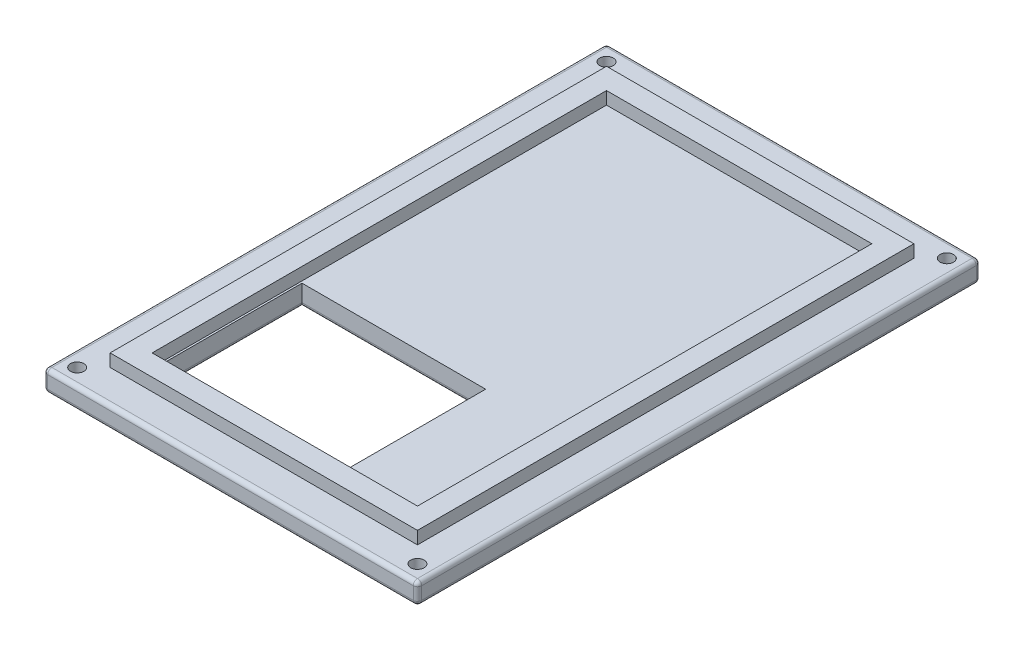
from build123d import *

# Parameters (mm, degrees)
SKETCH1_W           = 89
SKETCH1_H           = 134
BOSS_EXTRUDE1_DEPTH = 2.5
SKETCH3_W           = 73.15
SKETCH3_H           = 118.15
SKETCH3_W_2         = 63.15
SKETCH3_H_2         = 108.15
BOSS_EXTRUDE2_DEPTH = 3
CUT_EXTRUDE1_REACH  = 82.829
SKETCH5_W           = 43.701404931
SKETCH5_H           = 35.210158561
FILLET1_R           = 1
SKETCH8_R           = 2.9
CUT_EXTRUDE2_DEPTH  = 2.5
CUT_EXTRUDE3_REACH  = 82.619
SKETCH9_R           = 1.6


with BuildPart() as part:
    # Sketch1 → Boss-Extrude1 (new, symmetric)
    with BuildSketch(Plane(origin=(0, 0, 0), x_dir=(1, 0, 0), z_dir=(0, 1, 0))):
        Rectangle(SKETCH1_W, SKETCH1_H)
    extrude(amount=BOSS_EXTRUDE1_DEPTH, both=True)

    # Sketch3 → Boss-Extrude2 (add)
    with BuildSketch(Plane(origin=(0, 2.5, 0), x_dir=(1, 0, 0), z_dir=(0, 1, 0))):
        Rectangle(SKETCH3_W, SKETCH3_H)
        Rectangle(SKETCH3_W_2, SKETCH3_H_2, mode=Mode.SUBTRACT)
    extrude(amount=BOSS_EXTRUDE2_DEPTH)

    # Sketch5 → Cut-Extrude1 (cut, up to next)
    with BuildSketch(Plane.XZ.offset(2.5), mode=Mode.PRIVATE) as cut_extrude1_sk1:
        with Locations((-9.260550175, 36.46992072)):
            Rectangle(SKETCH5_W, SKETCH5_H)
    cut_extrude1_tool1 = extrude(cut_extrude1_sk1.sketch, amount=-CUT_EXTRUDE1_REACH, mode=Mode.PRIVATE) & part.part
    add(cut_extrude1_tool1.solids().sort_by_distance((-9.26055, -2.5, 36.469921))[0], mode=Mode.SUBTRACT)

    # Fillet1
    fillet1_edges = [part.edges().sort_by_distance(p)[0] for p in [
        (-44.5, 2.5, 0),
        (0, 2.5, 67),
        (-31.11125264, -2.5, 36.46992072),
        (-9.260550175, -2.5, 18.864841439),
        (12.590152291, -2.5, 36.46992072),
        (-9.260550175, -2.5, 54.075),
        (44.5, 2.5, 0),
        (0, -2.5, 67),
        (-44.5, -2.5, 0),
        (0, -2.5, -67),
        (44.5, -2.5, 0),
        (44.5, 0, 67),
        (-44.5, 0, 67),
        (-44.5, 0, -67),
        (44.5, 0, -67),
        (0, 2.5, -67),
    ]]
    fillet(fillet1_edges, radius=FILLET1_R)

    # Sketch8 → Cut-Extrude2 (cut)
    with BuildSketch(Plane.XZ.offset(2.5)):
        with Locations(Location((40.49479618, -62.99479618, 0), (0, 0, 270))):
            Circle(SKETCH8_R)
        with Locations(Location((-40.49479618, -62.99479618, 0), (0, 0, 90))):
            Circle(SKETCH8_R)
        with Locations(Location((40.49479618, 62.99479618, 0), (0, 0, 90))):
            Circle(SKETCH8_R)
        with Locations(Location((-40.49479618, 62.99479618, 0), (0, 0, 270))):
            Circle(SKETCH8_R)
    extrude(amount=-CUT_EXTRUDE2_DEPTH, mode=Mode.SUBTRACT)

    # Sketch9 → Cut-Extrude3 (cut, up to next)
    with BuildSketch(Plane.XZ, mode=Mode.PRIVATE) as cut_extrude3_sk1:
        with Locations(Location((40.49479618, -62.99479618, 0), (0, 0, 270))):
            Circle(SKETCH9_R)
    cut_extrude3_tool1 = extrude(cut_extrude3_sk1.sketch, amount=-CUT_EXTRUDE3_REACH, mode=Mode.PRIVATE) & part.part
    # Sketch9 → Cut-Extrude3 (cut, up to next)
    with BuildSketch(Plane.XZ, mode=Mode.PRIVATE) as cut_extrude3_sk2:
        with Locations(Location((-40.49479618, -62.99479618, 0), (0, 0, 270))):
            Circle(SKETCH9_R)
    cut_extrude3_tool2 = extrude(cut_extrude3_sk2.sketch, amount=-CUT_EXTRUDE3_REACH, mode=Mode.PRIVATE) & part.part
    # Sketch9 → Cut-Extrude3 (cut, up to next)
    with BuildSketch(Plane.XZ, mode=Mode.PRIVATE) as cut_extrude3_sk3:
        with Locations(Location((40.49479618, 62.99479618, 0), (0, 0, 270))):
            Circle(SKETCH9_R)
    cut_extrude3_tool3 = extrude(cut_extrude3_sk3.sketch, amount=-CUT_EXTRUDE3_REACH, mode=Mode.PRIVATE) & part.part
    # Sketch9 → Cut-Extrude3 (cut, up to next)
    with BuildSketch(Plane.XZ, mode=Mode.PRIVATE) as cut_extrude3_sk4:
        with Locations(Location((-40.49479618, 62.99479618, 0), (0, 0, 270))):
            Circle(SKETCH9_R)
    cut_extrude3_tool4 = extrude(cut_extrude3_sk4.sketch, amount=-CUT_EXTRUDE3_REACH, mode=Mode.PRIVATE) & part.part
    add(cut_extrude3_tool1.solids().sort_by_distance((40.494796, 0, -62.994796))[0], mode=Mode.SUBTRACT)
    add(cut_extrude3_tool2.solids().sort_by_distance((-40.494796, 0, -62.994796))[0], mode=Mode.SUBTRACT)
    add(cut_extrude3_tool3.solids().sort_by_distance((40.494796, 0, 62.994796))[0], mode=Mode.SUBTRACT)
    add(cut_extrude3_tool4.solids().sort_by_distance((-40.494796, 0, 62.994796))[0], mode=Mode.SUBTRACT)


solid = part.part
